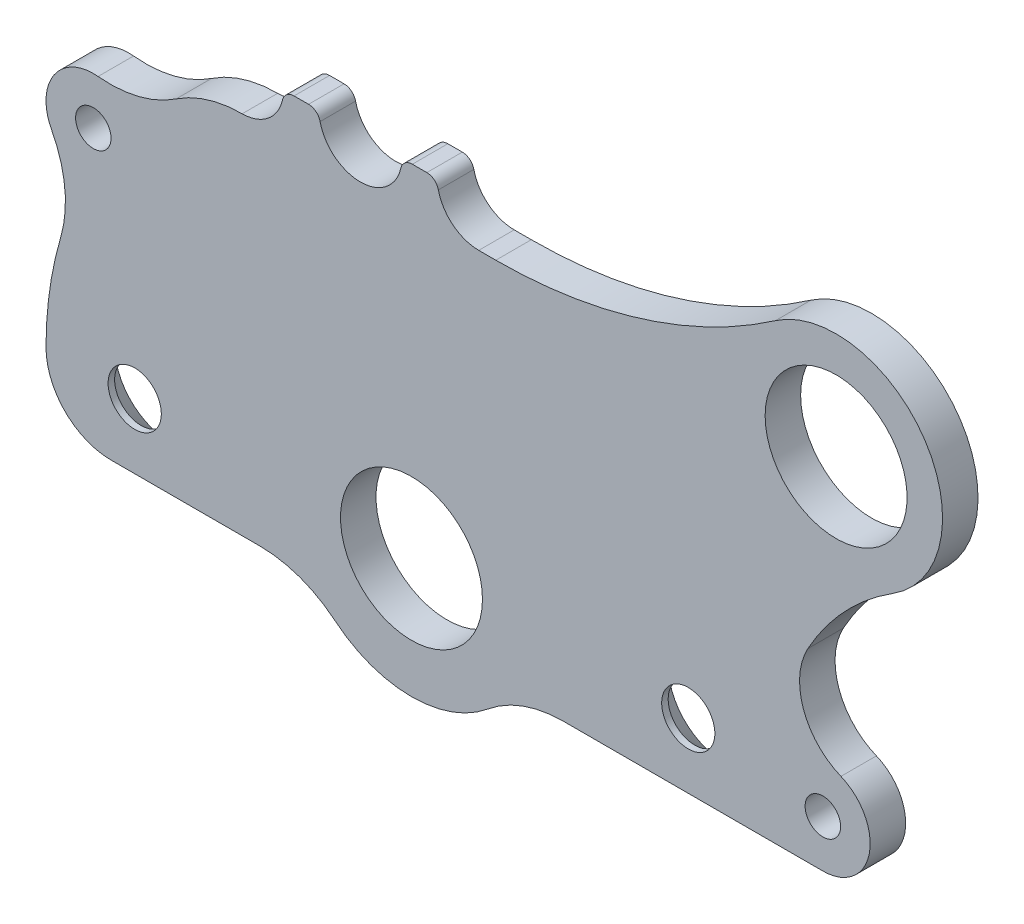
from build123d import *

# Parameters (mm, degrees)
SKETCH1_R                                           = 6
BOSS_EXTRUDE1_DEPTH                                 = 1.5
SKETCH2_R                                           = 4
SKETCH2_R_2                                         = 1.5
BOSS_EXTRUDE2_DEPTH                                 = 3
FILLET1_R                                           = 10
CSK_FOR_M4_COUNTERSUNK_FLAT_HEAD_SCREW1_D           = 4.5
CSK_FOR_M4_COUNTERSUNK_FLAT_HEAD_SCREW1_DEPTH       = 7.5
CSK_FOR_M4_COUNTERSUNK_FLAT_HEAD_SCREW1_CSINK_D     = 9.4
CSK_FOR_M4_COUNTERSUNK_FLAT_HEAD_SCREW1_CSINK_ANGLE = 90
CSK_FOR_M4_COUNTERSUNK_FLAT_HEAD_SCREW1_TIP         = 1.351936393
CUT_EXTRUDE1_DEPTH                                  = 44.802054894
FILLET2_R                                           = 10
SKETCH7_R                                           = 6
BOSS_EXTRUDE6_DEPTH                                 = 3
SKETCH10_R                                          = 1.5
BOSS_EXTRUDE7_DEPTH                                 = 3
BOSS_EXTRUDE8_DEPTH                                 = 3
FILLET3_R                                           = 1


with BuildPart() as part:
    # Sketch1 → Boss-Extrude1 (new, symmetric)
    with BuildSketch(Plane.XY):
        with BuildLine():
            Line((-25.4, -5.5), (-12.834896467, -5.5))
            ThreePointArc((-12.834896467, -5.5), (-9.445323242, -6.091982496), (-6.457063621, -7.797841329))
            ThreePointArc((-6.457063621, -7.797841329), (0, -10.124228366), (6.457063621, -7.797841329))
            ThreePointArc((6.457063621, -7.797841329), (9.445323242, -6.091982496), (12.834896467, -5.5))
            Line((12.834896467, -5.5), (25.4, -5.5))
            ThreePointArc((25.4, -5.5), (29.289087297, -3.889087297), (30.9, 0))
            ThreePointArc((30.9, 0), (0, 30.9), (-30.9, 0))
            ThreePointArc((-30.9, 0), (-29.289087297, -3.889087297), (-25.4, -5.5))
        make_face()
        Circle(SKETCH1_R, mode=Mode.SUBTRACT)
    extrude(amount=BOSS_EXTRUDE1_DEPTH, both=True)

    # Sketch2 → Boss-Extrude2 (add, through all)
    with BuildSketch(Plane.XY.offset(1.5)):
        with Locations((-26.9, 18.059623473)):
            Circle(SKETCH2_R)
        with Locations((-26.9, 18.059623473)):
            Circle(SKETCH2_R_2, mode=Mode.SUBTRACT)
    extrude(amount=-BOSS_EXTRUDE2_DEPTH)

    # Fillet1
    fillet1_edges = [part.edges().sort_by_distance(p)[0] for p in [
        (-27.493457726, 14.10389245, 0),
        (-23.463459093, 20.106618, 0),
    ]]
    fillet(fillet1_edges, radius=FILLET1_R)

    # CSK for M4 Countersunk Flat Head Screw1
    with Locations(Plane(origin=(0, 0, -1.5), x_dir=(-1, 0, 0), z_dir=(0, 0, -1))):
        with Locations((-23.4, 0), (23.4, 0)):
            CounterSinkHole(CSK_FOR_M4_COUNTERSUNK_FLAT_HEAD_SCREW1_D / 2, CSK_FOR_M4_COUNTERSUNK_FLAT_HEAD_SCREW1_CSINK_D / 2, depth=CSK_FOR_M4_COUNTERSUNK_FLAT_HEAD_SCREW1_DEPTH, counter_sink_angle=CSK_FOR_M4_COUNTERSUNK_FLAT_HEAD_SCREW1_CSINK_ANGLE)
            with Locations((0, 0, -(CSK_FOR_M4_COUNTERSUNK_FLAT_HEAD_SCREW1_DEPTH + CSK_FOR_M4_COUNTERSUNK_FLAT_HEAD_SCREW1_TIP / 2))):  # 118° drill point
                Cone(0, CSK_FOR_M4_COUNTERSUNK_FLAT_HEAD_SCREW1_D / 2, CSK_FOR_M4_COUNTERSUNK_FLAT_HEAD_SCREW1_TIP, mode=Mode.SUBTRACT)

    # Sketch6 → Cut-Extrude1 (cut, through all)
    with BuildSketch(Plane.XY.offset(1.5)):
        with BuildLine():
            Line((-17.596874723, 25.4), (17.596874723, 25.4))
            ThreePointArc((17.596874723, 25.4), (0, 30.9), (-17.596874723, 25.4))
        make_face()
    extrude(amount=-CUT_EXTRUDE1_DEPTH, mode=Mode.SUBTRACT)

    # Fillet2
    fillet2_edges = [part.edges().sort_by_distance(p)[0] for p in [
        (17.596874723, 25.4, 0),
        (-17.596874723, 25.4, 0),
    ]]
    fillet(fillet2_edges, radius=FILLET2_R)

    # Sketch7 → Boss-Extrude6 (add, through all)
    with BuildSketch(Plane(origin=(0, 0, -1.5), x_dir=(-1, 0, 0), z_dir=(0, 0, -1))):
        with BuildLine():
            Line((-14.129755837, 25.4), (-7.129755837, 25.4))
            ThreePointArc((-7.129755837, 25.4), (-19.515300955, 27.292035274), (-30.771089101, 32.795557652))
            ThreePointArc((-30.771089101, 32.795557652), (-43.404263963, 30.368503031), (-40.705792002, 17.790508346))
            ThreePointArc((-40.705792002, 17.790508346), (-33.513792252, 10.156964901), (-30.9, 0))
            ThreePointArc((-30.9, 0), (-28.287130475, 12.435764935), (-20.890404562, 22.768421053))
            ThreePointArc((-20.890404562, 22.768421053), (-17.757137087, 24.718911163), (-14.129755837, 25.4))
        make_face()
        with Locations((-35.9, 25.4)):
            Circle(SKETCH7_R, mode=Mode.SUBTRACT)
    extrude(amount=-BOSS_EXTRUDE6_DEPTH)

    # Sketch10 → Boss-Extrude7 (add, through all)
    with BuildSketch(Plane(origin=(0, 0, -1.5), x_dir=(-1, 0, 0), z_dir=(0, 0, -1))):
        with BuildLine():
            Line((-34.78083152, -5.5), (-25.4, -5.5))
            ThreePointArc((-25.4, -5.5), (-29.289087297, -3.889087297), (-30.9, 0))
            ThreePointArc((-30.9, 0), (-31.563922472, 5.243945221), (-33.513792252, 10.156964901))
            ThreePointArc((-33.513792252, 10.156964901), (-33.13038334, 5.551807562), (-36.308268134, 2.196882117))
            ThreePointArc((-36.308268134, 2.196882117), (-38.704320303, -2.278611434), (-34.78083152, -5.5))
        make_face()
        with Locations((-34.78083152, -1.5)):
            Circle(SKETCH10_R, mode=Mode.SUBTRACT)
    extrude(amount=-BOSS_EXTRUDE7_DEPTH)

    # Sketch12 → Boss-Extrude8 (add, through all)
    with BuildSketch(Plane(origin=(0, 0, -1.5), x_dir=(-1, 0, 0), z_dir=(0, 0, -1))):
        with BuildLine():
            ThreePointArc((7.813736863, 28.9), (6.788610597, 26.425126266), (4.313736863, 25.4))
            Line((4.313736863, 25.4), (14.313736863, 25.4))
            ThreePointArc((14.313736863, 25.4), (11.838863129, 26.425126266), (10.813736863, 28.9))
            Line((10.813736863, 28.9), (7.813736863, 28.9))
        make_face()
        with BuildLine():
            ThreePointArc((4.313736863, 25.4), (1.838863129, 26.425126266), (0.813736863, 28.9))
            Line((0.813736863, 28.9), (-2.186263137, 28.9))
            ThreePointArc((-2.186263137, 28.9), (-3.211389403, 26.425126266), (-5.686263137, 25.4))
            Line((-5.686263137, 25.4), (4.313736863, 25.4))
        make_face()
    extrude(amount=-BOSS_EXTRUDE8_DEPTH)

    # Fillet3
    fillet3_edges = [part.edges().sort_by_distance(p)[0] for p in [
        (-10.813736863, 28.9, 0),
        (-7.813736863, 28.9, 0),
        (2.186263137, 28.9, 0),
        (-0.813736863, 28.9, 0),
    ]]
    fillet(fillet3_edges, radius=FILLET3_R)


solid = part.part
